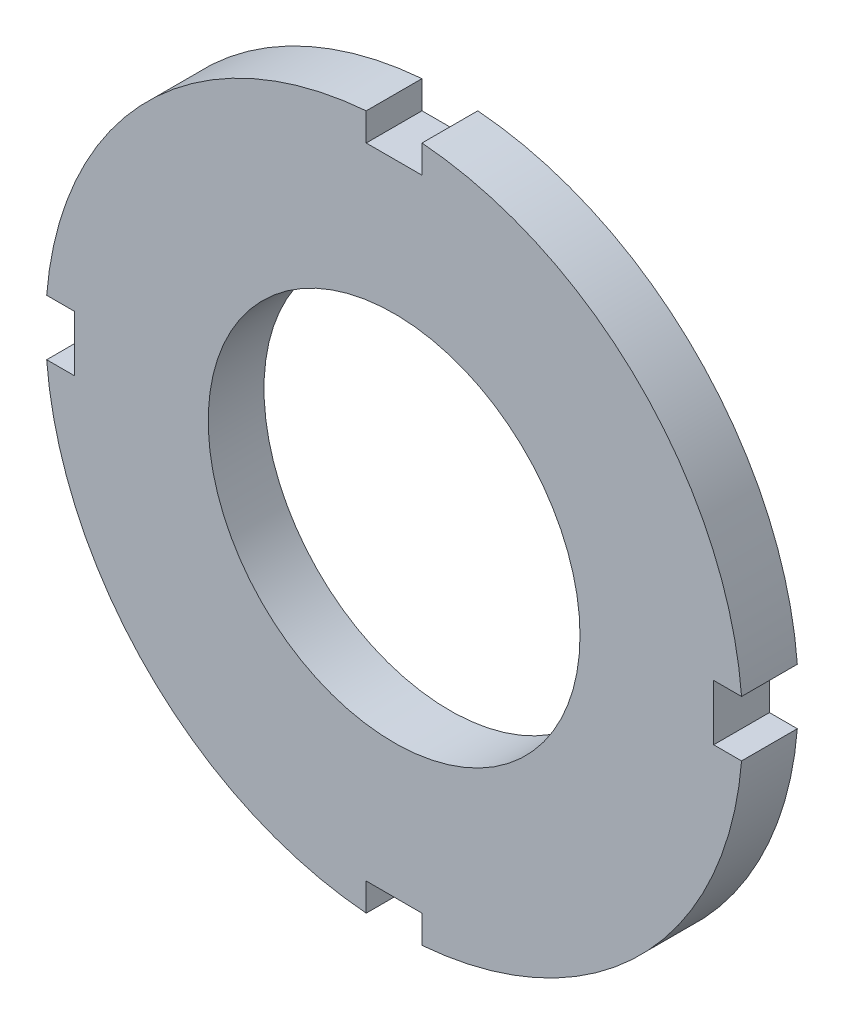
from build123d import *

# Parameters (mm, degrees)
SKETCH_1_R      = 20
EXTRUDE_1_DEPTH = 6


with BuildPart() as part:
    # 草图1 → 拉伸1 (new body)
    with BuildSketch(Plane.XY):
        with BuildLine():
            Line((34.379807383, -3), (37.379807383, -3))
            ThreePointArc((37.379807383, -3), (26.516504294, -26.516504294), (3, -37.379807383))
            Line((3, -37.379807383), (3, -34.379807383))
            Line((3, -34.379807383), (-3, -34.379807383))
            Line((-3, -34.379807383), (-3, -37.379807383))
            ThreePointArc((-3, -37.379807383), (-26.516504294, -26.516504294), (-37.379807383, -3))
            Line((-37.379807383, -3), (-34.379807383, -3))
            Line((-34.379807383, -3), (-34.379807383, 3))
            Line((-34.379807383, 3), (-37.379807383, 3))
            ThreePointArc((-37.379807383, 3), (-26.516504294, 26.516504294), (-3, 37.379807383))
            Line((-3, 37.379807383), (-3, 34.379807383))
            Line((-3, 34.379807383), (3, 34.379807383))
            Line((3, 34.379807383), (3, 37.379807383))
            ThreePointArc((3, 37.379807383), (26.516504294, 26.516504294), (37.379807383, 3))
            Line((37.379807383, 3), (34.379807383, 3))
            Line((34.379807383, 3), (34.379807383, -3))
        make_face()
        Circle(SKETCH_1_R, mode=Mode.SUBTRACT)
    extrude(amount=EXTRUDE_1_DEPTH)


solid = part.part
